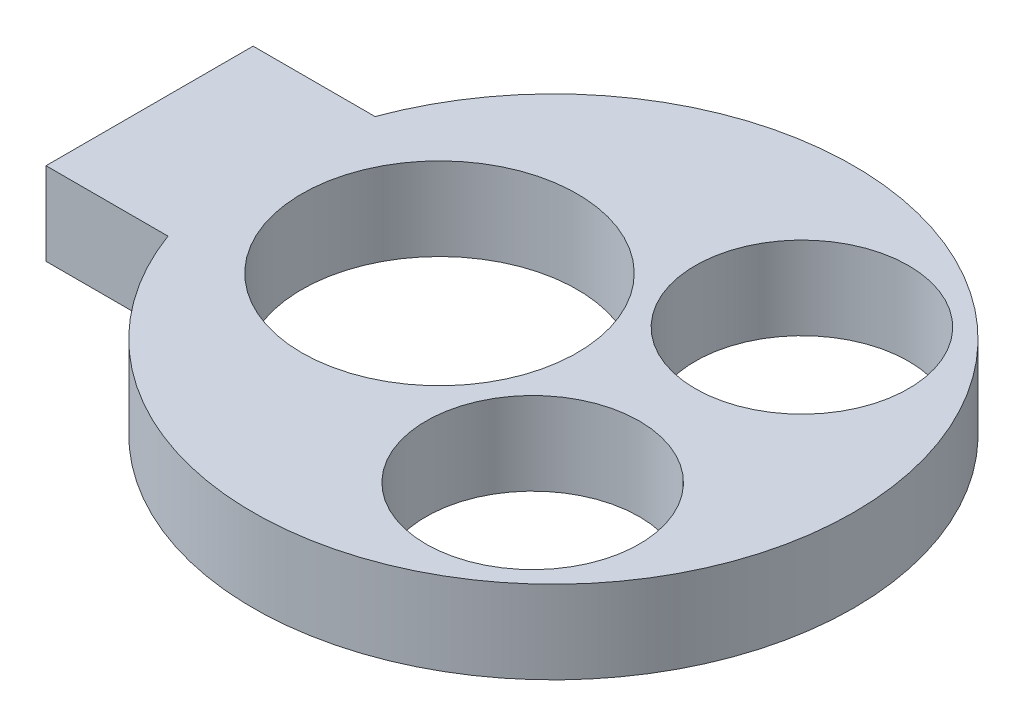
from build123d import *

# Parameters (mm, degrees)
SKETCH1_R             = 14.5
SKETCH1_R_2           = 6.65
SKETCH1_R_3           = 5.15
DISCO_SEPARADOR_DEPTH = 4
SKETCH2_W             = 7
SKETCH2_H             = 10
PATA_AL_HUESO_DEPTH   = 4


with BuildPart() as part:
    # Sketch1 → Disco_separador (new body)
    with BuildSketch(Plane(origin=(0, -2, 0), x_dir=(1, 0, 0), z_dir=(0, 1, 0))):
        with Locations(Location((0, 0, 0), (0, 0, 270))):
            Circle(SKETCH1_R)
        with Locations(Location((-5.5, 0, 0), (0, 0, 270))):
            Circle(SKETCH1_R_2, mode=Mode.SUBTRACT)
        with Locations(Location((5.5, -6.5, 0), (0, 0, 270))):
            Circle(SKETCH1_R_3, mode=Mode.SUBTRACT)
        with Locations(Location((5.5, 6.5, 0), (0, 0, 270))):
            Circle(SKETCH1_R_3, mode=Mode.SUBTRACT)
    extrude(amount=DISCO_SEPARADOR_DEPTH)

    # Sketch2 → Pata_al_hueso (add)
    with BuildSketch(Plane(origin=(0, -2, 0), x_dir=(1, 0, 0), z_dir=(0, 1, 0))):
        with Locations((-16, 0)):
            Rectangle(SKETCH2_W, SKETCH2_H)
    extrude(amount=PATA_AL_HUESO_DEPTH)


solid = part.part
